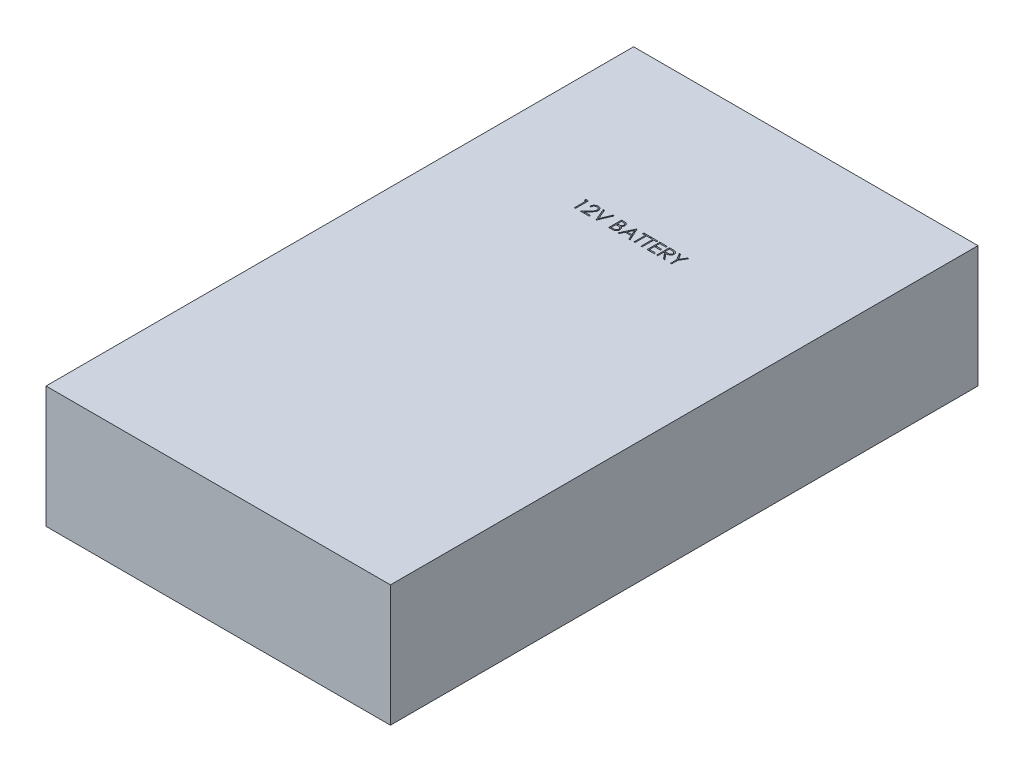
from build123d import *

# Parameters (mm, degrees)
SKETCH1_W           = 85
SKETCH1_H           = 145
BOSS_EXTRUDE1_DEPTH = 30
CUT_EXTRUDE1_DEPTH  = 1


with BuildPart() as part:
    # Sketch1 → Boss-Extrude1 (new body)
    with BuildSketch(Plane(origin=(0, 0, 0), x_dir=(1, 0, 0), z_dir=(0, 1, 0))):
        Rectangle(SKETCH1_W, SKETCH1_H)
    extrude(amount=BOSS_EXTRUDE1_DEPTH)

    # Sketch2 → Cut-Extrude1 (cut)
    # profile 1 of 10: a face of its own
    with BuildSketch(Plane(origin=(0, 30, 0), x_dir=(1, 0, 0), z_dir=(0, 1, 0))):
        Polygon((-15.706970997, 33.988479917), (-15.119926726, 33.988479917), (-15.119926726, 30.813479917), (-15.404862623, 30.813479917), (-15.404862623, 33.662838891), (-15.893324162, 33.662838891), align=None)
    # profile 2 of 10: a face of its own
    with BuildSketch(Plane(origin=(0, 30, 0), x_dir=(1, 0, 0), z_dir=(0, 1, 0))):
        with BuildLine():
            Line((-13.532426726, 33.01155684), (-13.817362623, 33.01155684))
            add(Edge.make_bspline(
                [(-13.817362623, 33.01155684), (-13.815505563, 33.049358288), (-13.811858346, 33.123599326), (-13.794778398, 33.231843156), (-13.770339174, 33.335307152), (-13.735784783, 33.433160574), (-13.692871231, 33.526268635), (-13.641408992, 33.614261506), (-13.580454571, 33.696803513), (-13.511324176, 33.773129464), (-13.436241196, 33.843149617), (-13.355227951, 33.903615445), (-13.270097105, 33.954703618), (-13.181106936, 33.99741303), (-13.087253425, 34.029471319), (-12.989388261, 34.053258092), (-12.887081473, 34.067569491), (-12.817376596, 34.069107811), (-12.781925924, 34.069890173)],
                knots=[0, 0, 0, 0, 1.10065271, 2.161652631, 3.183658789, 4.190468796, 5.17591951, 6.163126047, 7.15150782, 8.156236427, 9.156009102, 10.134482811, 11.092018607, 12.041330605, 13.001268258, 13.972401359, 14.968799086, 16, 16, 16, 16], degree=3))
            add(Edge.make_bspline(
                [(-12.781925924, 34.069890173), (-12.747111529, 34.069075145), (-12.678702485, 34.067473643), (-12.578860514, 34.053720424), (-12.48381254, 34.03217978), (-12.393744352, 34.001957938), (-12.309374565, 33.961332065), (-12.230069374, 33.912530012), (-12.154884639, 33.856087736), (-12.087205628, 33.789636063), (-12.025059013, 33.718695328), (-11.971444825, 33.642959873), (-11.925531455, 33.564737592), (-11.887261202, 33.483432009), (-11.859088848, 33.398277576), (-11.837700045, 33.310514042), (-11.825610177, 33.219232964), (-11.823754685, 33.157450588), (-11.822811341, 33.126040013)],
                knots=[0, 0, 0, 0, 1.111607364, 2.184268762, 3.212621178, 4.221274766, 5.211760367, 6.196651075, 7.1921475, 8.207485113, 9.220403448, 10.201281604, 11.166441695, 12.114753415, 13.065576456, 14.026450734, 14.996634279, 16, 16, 16, 16], degree=3))
            add(Edge.make_bspline(
                [(-11.822811341, 33.126040013), (-11.824347372, 33.081818763), (-11.82739248, 32.994152284), (-11.853440521, 32.865324515), (-11.894122714, 32.740507628), (-11.94310603, 32.640053075), (-11.992520319, 32.559105549), (-12.037049701, 32.492458938), (-12.089178494, 32.420698977), (-12.149665417, 32.344065964), (-12.217259236, 32.261959643), (-12.292572199, 32.174429614), (-12.376141358, 32.082380223), (-12.434795855, 32.019510142), (-12.465189146, 31.986932441)],
                knots=[0, 0, 0, 0, 1.184426356, 2.348067706, 3.509069118, 4.696110526, 5.333549288, 6.050745305, 6.844228056, 7.710549037, 8.667450064, 9.695053472, 10.805634456, 12, 12, 12, 12], degree=3))
            Line((-12.465189146, 31.986932441), (-13.259575163, 31.139120943))
            Line((-13.259575163, 31.139120943), (-11.782106213, 31.139120943))
            Line((-11.782106213, 31.139120943), (-11.782106213, 30.813479917))
            Line((-11.782106213, 30.813479917), (-13.939478008, 30.813479917))
            Line((-13.939478008, 30.813479917), (-12.70814788, 32.127492337))
            add(Edge.make_bspline(
                [(-12.70814788, 32.127492337), (-12.678168725, 32.158787229), (-12.620584905, 32.218898313), (-12.539139282, 32.306657998), (-12.465988199, 32.388073653), (-12.400658136, 32.46299145), (-12.344566313, 32.53250723), (-12.29478936, 32.594369568), (-12.254906288, 32.651296819), (-12.211621608, 32.717282948), (-12.169698925, 32.797848407), (-12.133674144, 32.896303968), (-12.111707818, 32.997656547), (-12.109072717, 33.066147681), (-12.107747239, 33.100599308)],
                knots=[0, 0, 0, 0, 1.329631726, 2.553950428, 3.673215718, 4.687767853, 5.603093632, 6.413772471, 7.123043292, 7.734684054, 8.834405432, 9.900288307, 10.943827018, 12, 12, 12, 12], degree=3))
            add(Edge.make_bspline(
                [(-12.107747239, 33.100599308), (-12.108323948, 33.122263148), (-12.109460531, 33.164958417), (-12.119491442, 33.227556498), (-12.134650258, 33.287940293), (-12.156372028, 33.346295541), (-12.185043856, 33.402035525), (-12.219944708, 33.455228096), (-12.260212837, 33.506653086), (-12.306795774, 33.554870721), (-12.357969082, 33.599031529), (-12.412029579, 33.638151235), (-12.469225031, 33.670843857), (-12.529314285, 33.697644029), (-12.592129818, 33.718667411), (-12.657793122, 33.733234836), (-12.726122766, 33.74238109), (-12.772780294, 33.743618588), (-12.79655433, 33.744249148)],
                knots=[0, 0, 0, 0, 0.991446411, 1.95395049, 2.89581595, 3.838931463, 4.798493298, 5.75982156, 6.748411868, 7.785213223, 8.824556874, 9.840280684, 10.836137867, 11.835679398, 12.848801643, 13.863922112, 14.911575587, 16, 16, 16, 16], degree=3))
            add(Edge.make_bspline(
                [(-12.79655433, 33.744249148), (-12.821383585, 33.743600511), (-12.870144143, 33.742326697), (-12.94173498, 33.733416137), (-13.010029936, 33.718043839), (-13.075200805, 33.697019284), (-13.137357858, 33.670296172), (-13.196198812, 33.637011518), (-13.251591576, 33.597293635), (-13.303640279, 33.552262559), (-13.35159546, 33.502126949), (-13.393729412, 33.446237911), (-13.43054491, 33.385615899), (-13.462666143, 33.320424485), (-13.488751662, 33.250072128), (-13.508684449, 33.174808567), (-13.524456803, 33.094960599), (-13.529725961, 33.039819844), (-13.532426726, 33.01155684)],
                knots=[0, 0, 0, 0, 1.031018746, 2.02475058, 2.990194455, 3.934040569, 4.864654155, 5.795059489, 6.735614925, 7.690564532, 8.649604399, 9.611025574, 10.590972636, 11.591080095, 12.624614302, 13.701020113, 14.821632451, 16, 16, 16, 16], degree=3))
        make_face()
    # profile 3 of 10: a face of its own
    with BuildSketch(Plane(origin=(0, 30, 0), x_dir=(1, 0, 0), z_dir=(0, 1, 0))):
        Polygon((-11.456465187, 33.988479917), (-11.151176726, 33.988479917), (-10.092843392, 31.486386568), (-9.034510059, 33.988479917), (-8.729221598, 33.988479917), (-10.072490828, 30.813479917), (-10.113195957, 30.813479917), align=None)
    # profile 4 of 10: a face of its own
    with BuildSketch(Plane(origin=(0, 30, 0), x_dir=(1, 0, 0), z_dir=(0, 1, 0))):
        with BuildLine():
            Line((-6.938195957, 33.988479917), (-6.318714787, 33.988479917))
            add(Edge.make_bspline(
                [(-6.318714787, 33.988479917), (-6.288390381, 33.988320486), (-6.229614137, 33.98801147), (-6.144143643, 33.983218915), (-6.064089365, 33.976684158), (-5.989428086, 33.966315431), (-5.920194306, 33.953804318), (-5.856179378, 33.938653385), (-5.797586864, 33.920486386), (-5.727634596, 33.891597259), (-5.647877997, 33.848668385), (-5.561519455, 33.785233187), (-5.487674181, 33.707643024), (-5.424005164, 33.620119472), (-5.373385577, 33.523839165), (-5.336764858, 33.421096901), (-5.313580213, 33.313217892), (-5.311195848, 33.239155866), (-5.309990828, 33.201726111)],
                knots=[0, 0, 0, 0, 1.001505555, 1.941167018, 2.826882275, 3.653841531, 4.429895133, 5.150066043, 5.825578002, 6.45369114, 7.647487171, 8.808567382, 9.977351308, 11.170798116, 12.373658725, 13.556498008, 14.765093433, 16, 16, 16, 16], degree=3))
            add(Edge.make_bspline(
                [(-5.309990828, 33.201726111), (-5.310982534, 33.166662721), (-5.312931328, 33.097759854), (-5.331566545, 32.996981626), (-5.360740866, 32.901050163), (-5.401294914, 32.810315571), (-5.454001724, 32.726827936), (-5.516466056, 32.649913773), (-5.591828584, 32.5828296), (-5.648292095, 32.545325681), (-5.676973, 32.52627539)],
                knots=[0, 0, 0, 0, 1.044552857, 2.05264487, 3.044412934, 4.028983338, 5.005914585, 5.980388656, 6.974128949, 8, 8, 8, 8], degree=3))
            add(Edge.make_bspline(
                [(-5.676973, 32.52627539), (-5.640904612, 32.512427855), (-5.571896851, 32.485934091), (-5.476931683, 32.439093348), (-5.395112073, 32.388146291), (-5.325808948, 32.332509541), (-5.266538361, 32.272539406), (-5.214783193, 32.207356552), (-5.170622232, 32.136110679), (-5.132782651, 32.059544615), (-5.10325628, 31.978440176), (-5.081143852, 31.893558114), (-5.06847338, 31.805202804), (-5.066670306, 31.745072495), (-5.065760059, 31.714716896)],
                knots=[0, 0, 0, 0, 1.27268992, 2.434971085, 3.483601985, 4.442670788, 5.356604649, 6.2567628, 7.179492994, 8.113709626, 9.066344395, 10.018646069, 10.999752585, 12, 12, 12, 12], degree=3))
            add(Edge.make_bspline(
                [(-5.065760059, 31.714716896), (-5.066646198, 31.683722662), (-5.068389701, 31.622740638), (-5.081252961, 31.533155624), (-5.103032651, 31.447544065), (-5.133032905, 31.365352221), (-5.172187291, 31.286739099), (-5.219837658, 31.211615638), (-5.276653434, 31.140736638), (-5.340210465, 31.073314494), (-5.412112554, 31.012692144), (-5.48968756, 30.958702896), (-5.573912436, 30.914301825), (-5.663403888, 30.87700372), (-5.759165803, 30.848512904), (-5.860768169, 30.828580641), (-5.968123357, 30.815150357), (-6.041792202, 30.814046178), (-6.079572158, 30.813479917)],
                knots=[0, 0, 0, 0, 0.978564426, 1.925352924, 2.850884081, 3.763762016, 4.682927383, 5.618979971, 6.567305752, 7.547517671, 8.540179244, 9.531824382, 10.526200242, 11.540722885, 12.589160233, 13.674978461, 14.80764778, 16, 16, 16, 16], degree=3))
            Line((-6.079572158, 30.813479917), (-6.938195957, 30.813479917))
            Line((-6.938195957, 30.813479917), (-6.938195957, 33.988479917))
        make_face()
        with BuildLine():
            Line((-6.653260059, 33.662838891), (-6.653260059, 32.645210686))
            Line((-6.653260059, 32.645210686), (-6.461818753, 32.645210686))
            add(Edge.make_bspline(
                [(-6.461818753, 32.645210686), (-6.433834489, 32.645573474), (-6.379763187, 32.646274453), (-6.301458709, 32.648282429), (-6.228773871, 32.65390494), (-6.161834137, 32.659525834), (-6.10074492, 32.668664925), (-6.04564156, 32.679543493), (-5.995659261, 32.6910487), (-5.938019817, 32.710615306), (-5.872639356, 32.739532911), (-5.802940755, 32.784410934), (-5.741495914, 32.83786374), (-5.689609894, 32.899541256), (-5.647145203, 32.967455581), (-5.617650618, 33.040523109), (-5.597650582, 33.1169228), (-5.595843979, 33.169372215), (-5.594926726, 33.196001952)],
                knots=[0, 0, 0, 0, 1.156816544, 2.235205308, 3.236616184, 4.169592532, 5.011045266, 5.787822928, 6.49130361, 7.128639758, 8.301311294, 9.436451833, 10.541879658, 11.654887649, 12.756523258, 13.837046038, 14.901820046, 16, 16, 16, 16], degree=3))
            add(Edge.make_bspline(
                [(-5.594926726, 33.196001952), (-5.595404046, 33.213623902), (-5.596340363, 33.248191281), (-5.604008716, 33.298582481), (-5.617042158, 33.345975028), (-5.633782839, 33.391018399), (-5.657176863, 33.432304149), (-5.684720862, 33.471259762), (-5.718000024, 33.506558613), (-5.755879872, 33.539550943), (-5.799430551, 33.568801337), (-5.84862608, 33.594419743), (-5.904132045, 33.615048876), (-5.965012992, 33.633115672), (-6.03220605, 33.645805053), (-6.104935823, 33.65637634), (-6.183798032, 33.661758184), (-6.238358233, 33.662470621), (-6.266561341, 33.662838891)],
                knots=[0, 0, 0, 0, 0.91205012, 1.789085906, 2.630437955, 3.453916878, 4.269457761, 5.079663411, 5.91843418, 6.774407191, 7.675494373, 8.627863946, 9.638891023, 10.736472738, 11.911756761, 13.175263542, 14.539845004, 16, 16, 16, 16], degree=3))
            Line((-6.266561341, 33.662838891), (-6.653260059, 33.662838891))
        make_face(mode=Mode.SUBTRACT)
        with BuildLine():
            Line((-6.653260059, 32.319569661), (-6.653260059, 31.139120943))
            Line((-6.653260059, 31.139120943), (-6.247480812, 31.139120943))
            add(Edge.make_bspline(
                [(-6.247480812, 31.139120943), (-6.218435072, 31.139469056), (-6.162453238, 31.14014), (-6.081625693, 31.142330346), (-6.006711021, 31.147312624), (-5.938051069, 31.155155645), (-5.874904444, 31.163663238), (-5.818028671, 31.175103472), (-5.766962702, 31.188210743), (-5.70774958, 31.208471028), (-5.641071398, 31.239945683), (-5.569215835, 31.28740216), (-5.505329194, 31.343938304), (-5.451077281, 31.409371347), (-5.406615498, 31.480519765), (-5.374270907, 31.555944476), (-5.354322058, 31.634399204), (-5.35190709, 31.687890436), (-5.350695957, 31.714716896)],
                knots=[0, 0, 0, 0, 1.160039823, 2.235823828, 3.228722157, 4.157150951, 4.99529583, 5.772374946, 6.472645482, 7.099169577, 8.269452708, 9.405989375, 10.527446681, 11.663510218, 12.788923519, 13.866172445, 14.929861265, 16, 16, 16, 16], degree=3))
            add(Edge.make_bspline(
                [(-5.350695957, 31.714716896), (-5.350946423, 31.731492998), (-5.351443315, 31.764774601), (-5.358936873, 31.813683952), (-5.369835169, 31.86106028), (-5.383924398, 31.90703223), (-5.404443486, 31.95076865), (-5.428397995, 31.993134543), (-5.456484409, 32.034185914), (-5.50024876, 32.086085601), (-5.563904774, 32.145881748), (-5.654353063, 32.204426482), (-5.757197934, 32.251641279), (-5.831790016, 32.271688661), (-5.870322359, 32.282044621)],
                knots=[0, 0, 0, 0, 0.723448775, 1.435228256, 2.130040452, 2.821711965, 3.505591119, 4.210454504, 4.921174351, 5.648778258, 7.137944449, 8.670945889, 10.280296675, 12, 12, 12, 12], degree=3))
            add(Edge.make_bspline(
                [(-5.870322359, 32.282044621), (-5.885770181, 32.285178875), (-5.919264247, 32.291974586), (-5.973881124, 32.299148003), (-6.036234376, 32.305538878), (-6.106467986, 32.310266143), (-6.184670814, 32.315152507), (-6.271009876, 32.317052809), (-6.365132583, 32.319319995), (-6.430439949, 32.31948431), (-6.464362824, 32.319569661)],
                knots=[0, 0, 0, 0, 0.634451884, 1.375622551, 2.216452059, 3.157844607, 4.20941857, 5.370758133, 6.634282058, 8, 8, 8, 8], degree=3))
            Line((-6.464362824, 32.319569661), (-6.653260059, 32.319569661))
        make_face(mode=Mode.SUBTRACT)
    # profile 5 of 10: a face of its own
    with BuildSketch(Plane(origin=(0, 30, 0), x_dir=(1, 0, 0), z_dir=(0, 1, 0))):
        Polygon((-3.111913905, 33.988479917), (-1.64652929, 30.813479917), (-1.956269875, 30.813479917), (-2.425650884, 31.831108122), (-3.864958777, 31.831108122), (-4.347696157, 30.813479917), (-4.658708777, 30.813479917), (-3.152619033, 33.988479917), align=None)
        Polygon((-3.135446557, 33.369634765), (-3.710406493, 32.156749148), (-2.575751045, 32.156749148), align=None, mode=Mode.SUBTRACT)
    # profile 6 of 10: a face of its own
    with BuildSketch(Plane(origin=(0, 30, 0), x_dir=(1, 0, 0), z_dir=(0, 1, 0))):
        Polygon((-1.443003649, 33.662838891), (-1.443003649, 33.988479917), (0.225906608, 33.988479917), (0.225906608, 33.662838891), (-0.466080572, 33.662838891), (-0.466080572, 30.813479917), (-0.751016469, 30.813479917), (-0.751016469, 33.662838891), align=None)
    # profile 7 of 10: a face of its own
    with BuildSketch(Plane(origin=(0, 30, 0), x_dir=(1, 0, 0), z_dir=(0, 1, 0))):
        Polygon((0.348021992, 33.662838891), (0.348021992, 33.988479917), (2.016932249, 33.988479917), (2.016932249, 33.662838891), (1.324945069, 33.662838891), (1.324945069, 30.813479917), (1.040009172, 30.813479917), (1.040009172, 33.662838891), align=None)
    # profile 8 of 10: a face of its own
    with BuildSketch(Plane(origin=(0, 30, 0), x_dir=(1, 0, 0), z_dir=(0, 1, 0))):
        Polygon((2.505393787, 33.988479917), (4.296419428, 33.988479917), (4.296419428, 33.662838891), (2.790329684, 33.662838891), (2.790329684, 32.685915814), (4.296419428, 32.685915814), (4.296419428, 32.360274789), (2.790329684, 32.360274789), (2.790329684, 31.139120943), (4.296419428, 31.139120943), (4.296419428, 30.813479917), (2.505393787, 30.813479917), align=None)
    # profile 9 of 10: a face of its own
    with BuildSketch(Plane(origin=(0, 30, 0), x_dir=(1, 0, 0), z_dir=(0, 1, 0))):
        with BuildLine():
            Line((4.866291223, 33.988479917), (5.501672834, 33.988479917))
            add(Edge.make_bspline(
                [(5.501672834, 33.988479917), (5.544073714, 33.988338778), (5.625488103, 33.988067776), (5.742122426, 33.986556691), (5.848101293, 33.982225669), (5.94336929, 33.978498597), (6.02792467, 33.971702335), (6.102026712, 33.965206606), (6.165334124, 33.956703356), (6.203657146, 33.948806294), (6.221008771, 33.945230718)],
                knots=[0, 0, 0, 0, 1.410062039, 2.707475311, 3.878576406, 4.937260626, 5.877586885, 6.699081471, 7.410979367, 8, 8, 8, 8], degree=3))
            add(Edge.make_bspline(
                [(6.221008771, 33.945230718), (6.244237637, 33.939491438), (6.290199835, 33.928135313), (6.356375966, 33.904132675), (6.419435389, 33.876356301), (6.479116158, 33.843732069), (6.53511934, 33.806017805), (6.588022379, 33.763864579), (6.638065335, 33.717503043), (6.683224385, 33.665764294), (6.725804811, 33.611484031), (6.76171735, 33.55278848), (6.792674943, 33.491409809), (6.817322483, 33.426723794), (6.837168931, 33.359357758), (6.851162733, 33.288701493), (6.859554882, 33.215076894), (6.86040928, 33.164859362), (6.860842505, 33.139396383)],
                knots=[0, 0, 0, 0, 1.027469482, 2.033020251, 3.019912614, 3.986113645, 4.951240523, 5.91722682, 6.890402269, 7.87763091, 8.8651537, 9.85103654, 10.82876324, 11.815024772, 12.821070561, 13.842952187, 14.906261191, 16, 16, 16, 16], degree=3))
            add(Edge.make_bspline(
                [(6.860842505, 33.139396383), (6.859509914, 33.097091681), (6.856909683, 33.01454425), (6.832666196, 32.894746165), (6.792954639, 32.782995858), (6.738232799, 32.679434037), (6.66854656, 32.58607938), (6.584794785, 32.504082324), (6.486930752, 32.435466118), (6.395827015, 32.38788393), (6.315350563, 32.357410363), (6.249098915, 32.335968809), (6.176829585, 32.319402598), (6.099235003, 32.304561621), (6.015992258, 32.29335687), (5.927300865, 32.285150316), (5.833097571, 32.280021286), (5.768382844, 32.279257468), (5.735091303, 32.278864532)],
                knots=[0, 0, 0, 0, 1.260483769, 2.459530307, 3.627416485, 4.787058657, 5.939039949, 7.08810263, 8.267026773, 9.491475466, 10.141966685, 10.831826277, 11.566392101, 12.351337768, 13.187381173, 14.07005841, 15.007169909, 16, 16, 16, 16], degree=3))
            Line((5.735091303, 32.278864532), (6.901547633, 30.813479917))
            Line((6.901547633, 30.813479917), (6.549193867, 30.813479917))
            Line((6.549193867, 30.813479917), (5.382737537, 32.278864532))
            Line((5.382737537, 32.278864532), (5.15122712, 32.278864532))
            Line((5.15122712, 32.278864532), (5.15122712, 30.813479917))
            Line((5.15122712, 30.813479917), (4.866291223, 30.813479917))
            Line((4.866291223, 30.813479917), (4.866291223, 33.988479917))
        make_face()
        with BuildLine():
            Line((5.15122712, 33.662838891), (5.15122712, 32.604505558))
            Line((5.15122712, 32.604505558), (5.732547233, 32.600053435))
            add(Edge.make_bspline(
                [(5.732547233, 32.600053435), (5.759688982, 32.600041427), (5.812297423, 32.600018153), (5.888407312, 32.603641079), (5.959273413, 32.607762517), (6.024624667, 32.614066567), (6.084490268, 32.622191003), (6.138840292, 32.63235371), (6.187763461, 32.644193796), (6.244821421, 32.662519556), (6.308535989, 32.691553587), (6.377779527, 32.733795146), (6.436745934, 32.786925705), (6.48656428, 32.847680197), (6.526595979, 32.914478794), (6.554819056, 32.986520786), (6.572728272, 33.06198745), (6.574840595, 33.113856162), (6.575906608, 33.140032401)],
                knots=[0, 0, 0, 0, 1.146690395, 2.22261258, 3.21895312, 4.145990853, 4.996080663, 5.770904154, 6.481378293, 7.121626537, 8.300444488, 9.431385265, 10.535395872, 11.636531494, 12.74115979, 13.810798291, 14.895190096, 16, 16, 16, 16], degree=3))
            add(Edge.make_bspline(
                [(6.575906608, 33.140032401), (6.574816112, 33.165565364), (6.572655148, 33.216162381), (6.555012336, 33.290235957), (6.525176969, 33.36014669), (6.484970367, 33.425610187), (6.43598542, 33.485033247), (6.378547118, 33.535876022), (6.314225977, 33.577830893), (6.254108533, 33.604640939), (6.20037464, 33.621078234), (6.153720591, 33.632645361), (6.101005179, 33.641938558), (6.041972442, 33.649384442), (5.976874391, 33.655784284), (5.905381872, 33.660094826), (5.827969221, 33.662647403), (5.774314505, 33.662773576), (5.74653962, 33.662838891)],
                knots=[0, 0, 0, 0, 1.101028733, 2.181837193, 3.264309656, 4.369019818, 5.486613113, 6.575447106, 7.666700264, 8.788928104, 9.402425223, 10.0903467, 10.862060571, 11.710948788, 12.657782767, 13.684531032, 14.801375019, 16, 16, 16, 16], degree=3))
            Line((5.74653962, 33.662838891), (5.15122712, 33.662838891))
        make_face(mode=Mode.SUBTRACT)
    # profile 10 of 10: a face of its own
    with BuildSketch(Plane(origin=(0, 30, 0), x_dir=(1, 0, 0), z_dir=(0, 1, 0))):
        Polygon((7.308598915, 33.988479917), (7.634875959, 33.988479917), (8.469331087, 32.624222105), (9.30251418, 33.988479917), (9.628791223, 33.988479917), (8.611163018, 32.322749749), (8.611163018, 30.813479917), (8.32622712, 30.813479917), (8.32622712, 32.322749749), align=None)
    extrude(amount=-CUT_EXTRUDE1_DEPTH, mode=Mode.SUBTRACT)


solid = part.part
